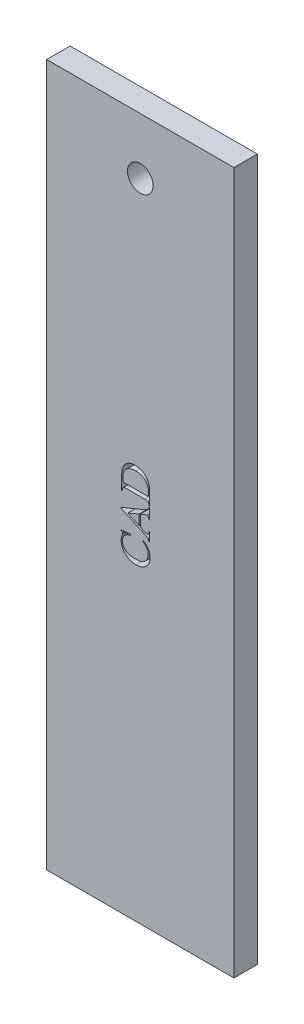
from build123d import *

# Parameters (mm, degrees)
SKETCH1_W           = 40
SKETCH1_H           = 5
BOSS_EXTRUDE1_DEPTH = 150
CUT_EXTRUDE1_DEPTH  = 5
SKETCH4_R           = 2.75
CUT_EXTRUDE2_DEPTH  = 152.410039413


with BuildPart() as part:
    # Sketch1 → Boss-Extrude1 (new body)
    with BuildSketch(Plane(origin=(0, 0, 0), x_dir=(1, 0, 0), z_dir=(0, 1, 0))):
        Rectangle(SKETCH1_W, SKETCH1_H)
    extrude(amount=BOSS_EXTRUDE1_DEPTH)

    # Sketch3 → Cut-Extrude1 (cut)
    # profile 1 of 3: a face of its own
    with BuildSketch(Plane.XY.offset(2.5)):
        with BuildLine():
            Line((-4.083333333, 70.942930124), (-2, 71.109596791))
            Line((-2, 71.109596791), (-2, 70.942930124))
            add(Edge.make_bspline(
                [(-2, 70.942930124), (-2.078824624, 70.92077859), (-2.231535874, 70.877863211), (-2.449815278, 70.801310882), (-2.651985976, 70.720746437), (-2.836210314, 70.62980745), (-3.004933621, 70.534725818), (-3.155198148, 70.429856354), (-3.288931448, 70.319200677), (-3.405785516, 70.201366033), (-3.506508046, 70.076442529), (-3.594254862, 69.946455238), (-3.66728622, 69.809459531), (-3.729246462, 69.667531354), (-3.776377349, 69.518251118), (-3.807745788, 69.362752715), (-3.830245375, 69.201825905), (-3.832293019, 69.092316704), (-3.833333333, 69.036680124)],
                knots=[0, 0, 0, 0, 1.365066222, 2.64461735, 3.855617696, 4.991804561, 6.068207555, 7.082157744, 8.043162699, 8.95929163, 9.844387829, 10.715614163, 11.57054311, 12.429689727, 13.294972967, 14.175083338, 15.072843931, 16, 16, 16, 16], degree=3))
            add(Edge.make_bspline(
                [(-3.833333333, 69.036680124), (-3.832120671, 68.989781088), (-3.82972451, 68.897110829), (-3.81706112, 68.759911546), (-3.793545405, 68.626213473), (-3.759195683, 68.496433159), (-3.717520325, 68.369271354), (-3.667079934, 68.245228016), (-3.605316804, 68.125480588), (-3.534926743, 68.008944017), (-3.45445045, 67.897049613), (-3.362855227, 67.790815987), (-3.259500257, 67.692031025), (-3.145329901, 67.598995828), (-3.019771357, 67.511899125), (-2.883626988, 67.429672342), (-2.735299514, 67.356205652), (-2.577783907, 67.286245133), (-2.408669553, 67.225920627), (-2.229632458, 67.172416234), (-2.040682104, 67.126475716), (-1.840857569, 67.091308094), (-1.631793153, 67.059973099), (-1.412106883, 67.042309676), (-1.183350188, 67.027879309), (-1.027369918, 67.026808769), (-0.947916667, 67.026263458)],
                knots=[0, 0, 0, 0, 0.852536779, 1.684572002, 2.501626613, 3.316698633, 4.122441197, 4.932535514, 5.747493007, 6.568687899, 7.405012473, 8.249518899, 9.114267231, 10.000094909, 10.923582836, 11.889523514, 12.887903456, 13.929955519, 15.020417887, 16.148493884, 17.325169382, 18.552146787, 19.835081454, 21.165613089, 22.556219601, 24, 24, 24, 24], degree=3))
            add(Edge.make_bspline(
                [(-0.947916667, 67.026263458), (-0.881926999, 67.026993881), (-0.752011328, 67.028431887), (-0.560847074, 67.040347258), (-0.376195045, 67.059840614), (-0.198447629, 67.086996742), (-0.026956435, 67.12168833), (0.136950158, 67.16667618), (0.294964091, 67.217100192), (0.446356592, 67.275154803), (0.588970574, 67.343213179), (0.724479122, 67.417334268), (0.850634571, 67.500689783), (0.968331411, 67.5924135), (1.077998574, 67.691227505), (1.178640008, 67.798343583), (1.269969444, 67.913694491), (1.353265956, 68.03587401), (1.427451701, 68.164613554), (1.491402946, 68.298753268), (1.544044009, 68.437705616), (1.591216024, 68.57956857), (1.62379316, 68.72723873), (1.649260336, 68.878826902), (1.663342626, 69.035112184), (1.665550911, 69.140821574), (1.666666667, 69.194232208)],
                knots=[0, 0, 0, 0, 1.236615865, 2.434559627, 3.587931865, 4.715311893, 5.803269128, 6.864816742, 7.898896901, 8.910956667, 9.900639854, 10.858179871, 11.803445678, 12.730869678, 13.652281606, 14.567244345, 15.481881623, 16.406876873, 17.336082669, 18.263863302, 19.188321939, 20.119519299, 21.062682956, 22.018805444, 22.998983368, 24, 24, 24, 24], degree=3))
            add(Edge.make_bspline(
                [(1.666666667, 69.194232208), (1.664175848, 69.285571183), (1.659305433, 69.464170606), (1.613641312, 69.723469137), (1.541107905, 69.96662775), (1.454486674, 70.157496885), (1.365395206, 70.303097353), (1.285680474, 70.415962282), (1.189891721, 70.53002445), (1.080327431, 70.647345617), (0.95573729, 70.76688477), (0.818263664, 70.891071624), (0.664167089, 71.015174081), (0.555770554, 71.097293738), (0.5, 71.139544708)],
                knots=[0, 0, 0, 0, 1.384369864, 2.706923932, 3.979392615, 5.225429667, 5.872362172, 6.566477539, 7.319183729, 8.12964106, 9.000244434, 9.937306366, 10.938733914, 12, 12, 12, 12], degree=3))
            Line((0.5, 71.139544708), (0.583333333, 71.276263458))
            add(Edge.make_bspline(
                [(0.583333333, 71.276263458), (0.64615724, 71.239472282), (0.769546919, 71.167212349), (0.945481702, 71.051844634), (1.107522834, 70.93031871), (1.25612529, 70.804061895), (1.391806578, 70.67322579), (1.516451349, 70.539735048), (1.626130677, 70.399575912), (1.722936857, 70.254448149), (1.807697348, 70.103637843), (1.883298852, 69.947351588), (1.942646118, 69.782486571), (1.996722632, 69.612914837), (2.034536594, 69.434799964), (2.063370405, 69.250557631), (2.080756858, 69.059149778), (2.082464075, 68.929510874), (2.083333333, 68.863503041)],
                knots=[0, 0, 0, 0, 1.164268116, 2.286687939, 3.362618883, 4.401641913, 5.403142802, 6.375793927, 7.320066215, 8.24609844, 9.163058491, 10.085232232, 11.018727147, 11.962871856, 12.929609851, 13.927061139, 14.944528248, 16, 16, 16, 16], degree=3))
            add(Edge.make_bspline(
                [(2.083333333, 68.863503041), (2.082727366, 68.804014051), (2.081531604, 68.686623845), (2.067719992, 68.513272984), (2.04728068, 68.344573527), (2.01789533, 68.180913895), (1.97741429, 68.02285483), (1.933702103, 67.86880045), (1.876087741, 67.721334297), (1.813185852, 67.57831006), (1.740763349, 67.440543948), (1.660288264, 67.307623983), (1.570106593, 67.180159336), (1.472270598, 67.057581127), (1.366632407, 66.939716405), (1.25117173, 66.82781764), (1.128476514, 66.719481387), (1.0403905, 66.653296536), (0.99609375, 66.620013458)],
                knots=[0, 0, 0, 0, 1.099867591, 2.170379506, 3.21370673, 4.241732154, 5.242319988, 6.230208013, 7.200627964, 8.167156574, 9.118536317, 10.076596279, 11.038581839, 12.003776478, 12.975622664, 13.963217193, 14.975741399, 16, 16, 16, 16], degree=3))
            add(Edge.make_bspline(
                [(0.99609375, 66.620013458), (0.927890794, 66.572301262), (0.792458331, 66.47755786), (0.575019733, 66.358020058), (0.350407476, 66.254606749), (0.115422256, 66.171122461), (-0.127905405, 66.10569019), (-0.380695276, 66.061226446), (-0.641621939, 66.03083111), (-0.818921077, 66.027800634), (-0.908854167, 66.026263458)],
                knots=[0, 0, 0, 0, 0.983524538, 1.953011393, 2.929009533, 3.904562341, 4.897931762, 5.904535192, 6.937097918, 8, 8, 8, 8], degree=3))
            add(Edge.make_bspline(
                [(-0.908854167, 66.026263458), (-0.981800326, 66.027714034), (-1.126147586, 66.030584463), (-1.34056419, 66.047444743), (-1.55030229, 66.076964886), (-1.755471278, 66.121290961), (-1.957033793, 66.173099954), (-2.153156725, 66.240705673), (-2.344954737, 66.318776235), (-2.531527975, 66.40825366), (-2.711304836, 66.507778926), (-2.880085985, 66.619108921), (-3.039921351, 66.736925183), (-3.187411605, 66.866313281), (-3.327175959, 67.001890696), (-3.454942835, 67.148711331), (-3.572514755, 67.303960911), (-3.67886197, 67.467713147), (-3.773828755, 67.637757311), (-3.855782392, 67.812940339), (-3.92663233, 67.991406966), (-3.983948813, 68.174205533), (-4.028319821, 68.360449067), (-4.059231133, 68.550641939), (-4.079734527, 68.744565207), (-4.082127576, 68.875603382), (-4.083333333, 68.941628041)],
                knots=[0, 0, 0, 0, 1.091951148, 2.160773889, 3.217383382, 4.259674575, 5.301317628, 6.330629974, 7.362154311, 8.399554235, 9.42623879, 10.435341404, 11.424162725, 12.395933382, 13.369895035, 14.33676691, 15.306102157, 16.282790242, 17.257098532, 18.219090555, 19.175802912, 20.129222765, 21.084168746, 22.039026323, 23.011947326, 24, 24, 24, 24], degree=3))
            add(Edge.make_bspline(
                [(-4.083333333, 68.941628041), (-4.0804453, 69.045126155), (-4.074650225, 69.252803592), (-4.02372351, 69.561878494), (-3.945620055, 69.869625287), (-3.867637069, 70.067786903), (-3.828125, 70.168190541)],
                knots=[0, 0, 0, 0, 0.984356359, 1.975191602, 2.974079167, 4, 4, 4, 4], degree=3))
            add(Edge.make_bspline(
                [(-3.828125, 70.168190541), (-3.816534388, 70.195419078), (-3.795208423, 70.245517799), (-3.770540425, 70.31493307), (-3.754421442, 70.371927009), (-3.751341257, 70.405970548), (-3.75, 70.420794708)],
                knots=[0, 0, 0, 0, 1.336236462, 2.458587416, 3.328796419, 4, 4, 4, 4], degree=3))
            add(Edge.make_bspline(
                [(-3.75, 70.420794708), (-3.752679761, 70.457398973), (-3.75797415, 70.529717827), (-3.797960913, 70.590162781), (-3.817708333, 70.620013458)],
                knots=[0, 0, 0, 0, 1.012302122, 2, 2, 2, 2], degree=3))
            add(Edge.make_bspline(
                [(-3.817708333, 70.620013458), (-3.834525417, 70.637557063), (-3.868629877, 70.673134885), (-3.931520309, 70.716233046), (-4.003523018, 70.75161789), (-4.056149901, 70.767869165), (-4.083333333, 70.776263458)],
                knots=[0, 0, 0, 0, 0.931005674, 1.888047171, 2.909110262, 4, 4, 4, 4], degree=3))
            Line((-4.083333333, 70.776263458), (-4.083333333, 70.942930124))
        make_face()
    # profile 2 of 3: a face of its own
    with BuildSketch(Plane.XY.offset(2.5)):
        with BuildLine():
            Line((0, 75.856992624), (0, 73.465065541))
            Line((0, 73.465065541), (0.9453125, 73.026263458))
            add(Edge.make_bspline(
                [(0.9453125, 73.026263458), (0.998854042, 73.003784405), (1.097984389, 72.962165204), (1.238144539, 72.915959399), (1.356170927, 72.883201249), (1.428666491, 72.878580691), (1.4609375, 72.876523874)],
                knots=[0, 0, 0, 0, 1.290167615, 2.388701517, 3.282739186, 4, 4, 4, 4], degree=3))
            add(Edge.make_bspline(
                [(1.4609375, 72.876523874), (1.483333809, 72.877848453), (1.527840078, 72.880480675), (1.591099778, 72.907656276), (1.649041945, 72.949339028), (1.69419257, 72.995751386), (1.725832562, 73.044269294), (1.747924116, 73.091273498), (1.769170479, 73.1471342), (1.784605521, 73.213518288), (1.800611946, 73.288534617), (1.815260551, 73.372674759), (1.82473642, 73.466717115), (1.830382538, 73.532334719), (1.833333333, 73.566628041)],
                knots=[0, 0, 0, 0, 0.929020094, 1.84616214, 2.819905009, 3.894778607, 4.522002042, 5.225937724, 6.055972126, 7.008132113, 8.061941281, 9.254596474, 10.565186794, 12, 12, 12, 12], degree=3))
            Line((1.833333333, 73.566628041), (2, 73.566628041))
            Line((2, 73.566628041), (2, 71.682513458))
            Line((2, 71.682513458), (1.833333333, 71.682513458))
            add(Edge.make_bspline(
                [(1.833333333, 71.682513458), (1.822439417, 71.739723546), (1.80259482, 71.8439387), (1.758578921, 71.98084956), (1.715801131, 72.089644812), (1.672602487, 72.142425067), (1.653645833, 72.165586374)],
                knots=[0, 0, 0, 0, 1.338419352, 2.438094121, 3.314596311, 4, 4, 4, 4], degree=3))
            add(Edge.make_bspline(
                [(1.653645833, 72.165586374), (1.633119075, 72.1850341), (1.589450817, 72.226406845), (1.512698442, 72.285159912), (1.421355576, 72.344490331), (1.315898802, 72.405235617), (1.196349089, 72.467981048), (1.063259956, 72.532749482), (0.914801815, 72.597885727), (0.810855354, 72.640633146), (0.756510417, 72.662982208)],
                knots=[0, 0, 0, 0, 0.657509844, 1.398774721, 2.244567789, 3.190193186, 4.229071695, 5.385194885, 6.63293641, 8, 8, 8, 8], degree=3))
            Line((0.756510417, 72.662982208), (-4.083333333, 74.912982208))
            Line((-4.083333333, 74.912982208), (-4.083333333, 75.077044708))
            Line((-4.083333333, 75.077044708), (0.861979167, 77.109596791))
            add(Edge.make_bspline(
                [(0.861979167, 77.109596791), (0.909484131, 77.129562566), (1.00084772, 77.167961602), (1.129348696, 77.230216728), (1.246595594, 77.287534104), (1.349870508, 77.345154066), (1.440062167, 77.400876341), (1.51724239, 77.45542465), (1.581719981, 77.508550882), (1.650145896, 77.578542296), (1.719373616, 77.675854487), (1.776803522, 77.811623231), (1.81809125, 77.965490793), (1.828096018, 78.075464856), (1.833333333, 78.133034291)],
                knots=[0, 0, 0, 0, 1.223989839, 2.354029848, 3.391605643, 4.324042249, 5.162387765, 5.909171864, 6.567979791, 7.144041755, 8.231258465, 9.380841669, 10.628917946, 12, 12, 12, 12], degree=3))
            Line((1.833333333, 78.133034291), (2, 78.133034291))
            Line((2, 78.133034291), (2, 75.764544708))
            Line((2, 75.764544708), (1.833333333, 75.764544708))
            add(Edge.make_bspline(
                [(1.833333333, 75.764544708), (1.829558619, 75.819333058), (1.822628701, 75.919917834), (1.79930332, 76.056231362), (1.764285033, 76.164417905), (1.716334244, 76.245182967), (1.659117577, 76.302107626), (1.596968951, 76.342077616), (1.528719115, 76.367036262), (1.481107515, 76.369878351), (1.45703125, 76.371315541)],
                knots=[0, 0, 0, 0, 1.654447139, 3.037364563, 4.158426283, 5.062515405, 5.839474064, 6.568837494, 7.27628881, 8, 8, 8, 8], degree=3))
            add(Edge.make_bspline(
                [(1.45703125, 76.371315541), (1.418664492, 76.368976011), (1.33122021, 76.363643831), (1.187761943, 76.324742652), (1.014791236, 76.271200349), (0.892031102, 76.222123603), (0.825520833, 76.195534291)],
                knots=[0, 0, 0, 0, 0.698820548, 1.592729354, 2.695763756, 4, 4, 4, 4], degree=3))
            Line((0.825520833, 76.195534291), (0, 75.856992624))
        make_face()
        Polygon((-0.25, 75.754128041), (-2.658854167, 74.734596791), (-0.25, 73.580950958), align=None, mode=Mode.SUBTRACT)
    # profile 3 of 3: a face of its own
    with BuildSketch(Plane.XY.offset(2.5)):
        with BuildLine():
            Line((2, 78.276263458), (1.833333333, 78.276263458))
            Line((1.833333333, 78.276263458), (1.833333333, 78.493711374))
            add(Edge.make_bspline(
                [(1.833333333, 78.493711374), (1.832635837, 78.523265422), (1.831286204, 78.580451533), (1.819442838, 78.662993325), (1.799999569, 78.73902924), (1.773153541, 78.808609872), (1.736693981, 78.87035201), (1.695715749, 78.927530569), (1.643875955, 78.976128538), (1.604557733, 79.002489728), (1.584635417, 79.015846791)],
                knots=[0, 0, 0, 0, 1.170016541, 2.263943595, 3.293731011, 4.273677885, 5.205400736, 6.126759273, 7.050839703, 8, 8, 8, 8], degree=3))
            add(Edge.make_bspline(
                [(1.584635417, 79.015846791), (1.570491514, 79.023610915), (1.539354927, 79.04070297), (1.483984543, 79.059551623), (1.417524768, 79.074383987), (1.339723693, 79.087548251), (1.250590722, 79.097352163), (1.149443433, 79.105552986), (1.036913371, 79.1087937), (0.957899532, 79.109321409), (0.916666667, 79.109596791)],
                knots=[0, 0, 0, 0, 0.568141805, 1.250715472, 2.052584266, 2.968455247, 4.031571596, 5.213625719, 6.545948453, 8, 8, 8, 8], degree=3))
            Line((0.916666667, 79.109596791), (-2.916666667, 79.109596791))
            add(Edge.make_bspline(
                [(-2.916666667, 79.109596791), (-2.962253888, 79.109657937), (-3.048708368, 79.109773897), (-3.171969587, 79.102308505), (-3.281974928, 79.094136645), (-3.378522879, 79.081371895), (-3.461804496, 79.064733115), (-3.531295594, 79.044002041), (-3.589745705, 79.022113874), (-3.620141653, 78.999980002), (-3.634114583, 78.989805124)],
                knots=[0, 0, 0, 0, 1.484107705, 2.814555366, 4.019988359, 5.075390106, 5.984573864, 6.780592097, 7.4394417, 8, 8, 8, 8], degree=3))
            add(Edge.make_bspline(
                [(-3.634114583, 78.989805124), (-3.664922921, 78.959945024), (-3.726856464, 78.899917708), (-3.789956749, 78.781536232), (-3.826341501, 78.643886307), (-3.830917198, 78.545606646), (-3.833333333, 78.493711374)],
                knots=[0, 0, 0, 0, 0.928124107, 1.865794122, 2.873060895, 4, 4, 4, 4], degree=3))
            Line((-3.833333333, 78.493711374), (-3.833333333, 78.276263458))
            Line((-3.833333333, 78.276263458), (-4, 78.276263458))
            Line((-4, 78.276263458), (-4, 80.734596791))
            add(Edge.make_bspline(
                [(-4, 80.734596791), (-3.998977623, 80.843990188), (-3.99699281, 81.056363253), (-3.982381406, 81.364675876), (-3.960019894, 81.653239089), (-3.925541969, 81.920637768), (-3.885458672, 82.168896264), (-3.831322714, 82.395846734), (-3.771497936, 82.604029044), (-3.699094393, 82.793074601), (-3.614067048, 82.966945033), (-3.519407392, 83.131714945), (-3.410844937, 83.287177384), (-3.288945527, 83.433584411), (-3.154770625, 83.571460576), (-3.008396965, 83.701143617), (-2.848506522, 83.820887356), (-2.677871648, 83.93234313), (-2.496930804, 84.032628449), (-2.307915808, 84.119718876), (-2.111773504, 84.194346423), (-1.909039887, 84.255320691), (-1.699372058, 84.302837446), (-1.482909498, 84.334021168), (-1.25958365, 84.356498449), (-1.10813171, 84.358553555), (-1.03125, 84.359596791)],
                knots=[0, 0, 0, 0, 1.467285284, 2.848543714, 4.139428074, 5.348239071, 6.464224292, 7.510631955, 8.47589724, 9.36787262, 10.221917022, 11.069687826, 11.914354515, 12.761885405, 13.622354629, 14.49261558, 15.382193837, 16.299385727, 17.224488554, 18.154414988, 19.088614209, 20.037143359, 20.991923033, 21.969244678, 22.969125506, 24, 24, 24, 24], degree=3))
            add(Edge.make_bspline(
                [(-1.03125, 84.359596791), (-0.928700402, 84.357578397), (-0.727698481, 84.353622251), (-0.432829072, 84.315640131), (-0.150832532, 84.256312434), (0.118933208, 84.17305949), (0.375252484, 84.064439637), (0.618446056, 83.931616903), (0.85100631, 83.777805931), (0.991719414, 83.655495556), (1.0625, 83.593971791)],
                knots=[0, 0, 0, 0, 1.077719575, 2.112379846, 3.120154608, 4.104514829, 5.075810074, 6.041644454, 7.014920789, 8, 8, 8, 8], degree=3))
            add(Edge.make_bspline(
                [(1.0625, 83.593971791), (1.10076398, 83.557576154), (1.177563845, 83.484526251), (1.283744782, 83.365823964), (1.38303587, 83.240700963), (1.474534098, 83.108311113), (1.559008898, 82.969258455), (1.636352848, 82.82288176), (1.70469307, 82.668886438), (1.767680511, 82.508840125), (1.82208805, 82.341248228), (1.870361733, 82.167143689), (1.910854168, 81.985495206), (1.94273119, 81.796760185), (1.96916504, 81.601402467), (1.987213875, 81.39894513), (1.997478589, 81.189565921), (1.999151302, 81.047542003), (2, 80.975482208)],
                knots=[0, 0, 0, 0, 0.884547214, 1.775380039, 2.665826882, 3.559504879, 4.469980105, 5.390593375, 6.331323642, 7.291529335, 8.271228182, 9.282197471, 10.317896576, 11.387954191, 12.488469157, 13.620281033, 14.792583212, 16, 16, 16, 16], degree=3))
            Line((2, 80.975482208), (2, 78.276263458))
        make_face()
        with BuildLine():
            add(Edge.make_bspline(
                [(1.622395833, 79.942930124), (1.641851126, 80.03522818), (1.67898463, 80.211393621), (1.719676964, 80.465468887), (1.744701684, 80.696330285), (1.748300816, 80.84261686), (1.75, 80.911680124)],
                knots=[0, 0, 0, 0, 1.156186088, 2.206764045, 3.153396487, 4, 4, 4, 4], degree=3))
            add(Edge.make_bspline(
                [(1.75, 80.911680124), (1.747853699, 80.997746968), (1.743629271, 81.167146897), (1.707167537, 81.415210944), (1.65034927, 81.652743874), (1.569362086, 81.879017651), (1.464557512, 82.093826172), (1.336215545, 82.296927367), (1.183504908, 82.487347562), (1.011436117, 82.667248545), (0.817617157, 82.829037906), (0.607063262, 82.972317783), (0.379284696, 83.092202382), (0.135201362, 83.190013779), (-0.124972263, 83.267112388), (-0.402245427, 83.321095679), (-0.695803124, 83.354256781), (-0.897045247, 83.357789476), (-1, 83.359596791)],
                knots=[0, 0, 0, 0, 0.997996022, 1.964292496, 2.902202989, 3.827540679, 4.746320531, 5.669683403, 6.608607029, 7.573643287, 8.552931756, 9.531909504, 10.522958759, 11.532773866, 12.577887131, 13.666093008, 14.805981493, 16, 16, 16, 16], degree=3))
            add(Edge.make_bspline(
                [(-1, 83.359596791), (-1.103821375, 83.357793807), (-1.306360487, 83.354276471), (-1.601247029, 83.321242276), (-1.879320499, 83.266928715), (-2.140365613, 83.189981687), (-2.385502275, 83.092525361), (-2.613511912, 82.972228844), (-2.824034348, 82.82944586), (-3.016554313, 82.667092883), (-3.188284209, 82.487129868), (-3.338869267, 82.294153389), (-3.466064836, 82.087941829), (-3.571009338, 81.869504497), (-3.651719219, 81.637926732), (-3.708868955, 81.394430126), (-3.743301125, 81.138794481), (-3.747735883, 80.96430532), (-3.75, 80.875221791)],
                knots=[0, 0, 0, 0, 1.19331062, 2.327960612, 3.406430637, 4.446978843, 5.452389227, 6.434571861, 7.404790988, 8.371500382, 9.324446655, 10.2597346, 11.18065483, 12.104692875, 13.040566373, 13.994348472, 14.976036595, 16, 16, 16, 16], degree=3))
            add(Edge.make_bspline(
                [(-3.75, 80.875221791), (-3.748452915, 80.804845408), (-3.745235413, 80.658482362), (-3.718921039, 80.432329514), (-3.676957052, 80.191634184), (-3.638446206, 80.027819949), (-3.618489583, 79.942930124)],
                knots=[0, 0, 0, 0, 0.894670856, 1.860663297, 2.891378894, 4, 4, 4, 4], degree=3))
            Line((-3.618489583, 79.942930124), (1.622395833, 79.942930124))
        make_face(mode=Mode.SUBTRACT)
    extrude(amount=-CUT_EXTRUDE1_DEPTH, mode=Mode.SUBTRACT)


with BuildPart() as cut_extrude1_piece_1:
    # of the separate pieces the step leaves, piece 1, a body of its own (cut_extrude1_pieces)
    add(part.part.solids().sort_by_distance((-20, 0, -2.5))[0])

    # Sketch4 → Cut-Extrude2 (cut, through all)
    with BuildSketch(Plane(origin=(0, 0, -2.5), x_dir=(-1, 0, 0), z_dir=(0, 0, -1))):
        with Locations((0, 138)):
            Circle(SKETCH4_R)
    extrude(amount=-CUT_EXTRUDE2_DEPTH, mode=Mode.SUBTRACT)


with BuildPart() as cut_extrude1_piece_2:
    # of the separate pieces the step leaves, piece 2, a body of its own (cut_extrude1_pieces)
    add(part.part.solids().sort_by_distance((1.622395833, 79.942930124, -2.5))[0])


with BuildPart() as cut_extrude1_piece_3:
    # of the separate pieces the step leaves, piece 3, a body of its own (cut_extrude1_pieces)
    add(part.part.solids().sort_by_distance((-0.25, 75.754128041, -2.5))[0])


solid = Compound([cut_extrude1_piece_1.part, cut_extrude1_piece_2.part, cut_extrude1_piece_3.part])
